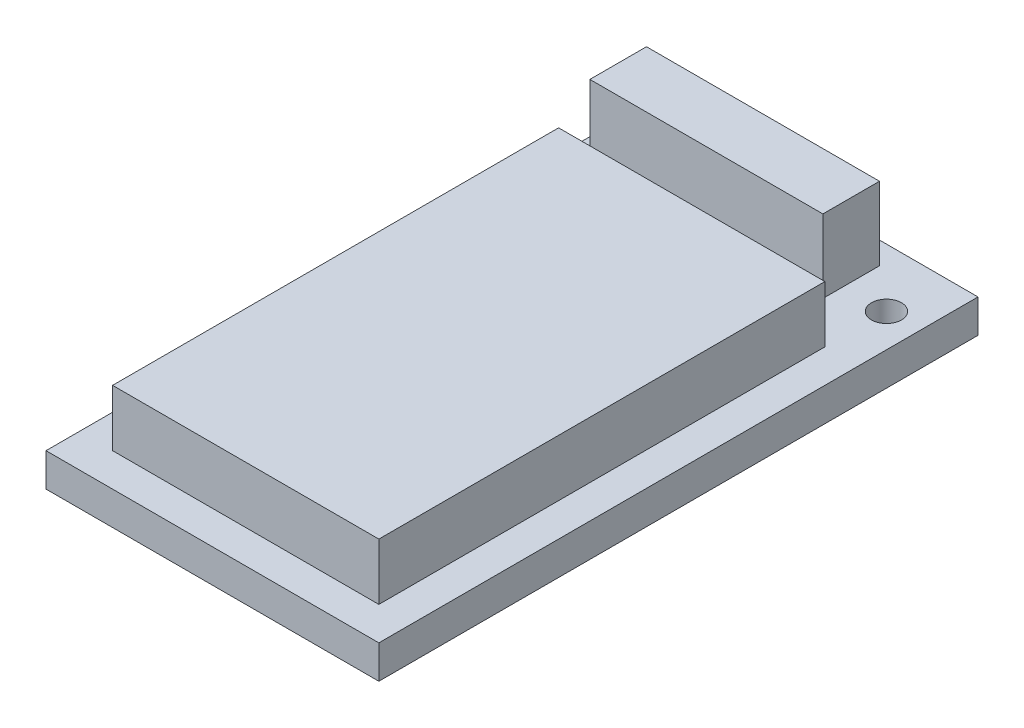
from build123d import *

# Parameters (mm, degrees)
ESQUISSE1_W                         = 10
ESQUISSE1_H                         = 18
BOSS_EXTRU_1_DEPTH                  = 1
ESQUISSE2_W                         = 8
ESQUISSE2_H                         = 13.4
BOSS_EXTRU_2_DEPTH                  = 1.7
ESQUISSE3_W                         = 7
ESQUISSE3_H                         = 1.7
BOSS_EXTRU_3_DEPTH                  = 2.2
DIAM_TRE_DU_PER_AGE_0_9_0_9_1_D     = 0.9
DIAM_TRE_DU_PER_AGE_0_9_0_9_1_DEPTH = 3.2


with BuildPart() as part:
    # Esquisse1 → Boss.-Extru.1 (new body)
    with BuildSketch(Plane(origin=(0, 1, 0), x_dir=(1, 0, 0), z_dir=(0, 1, 0))):
        Rectangle(ESQUISSE1_W, ESQUISSE1_H)
    extrude(amount=-BOSS_EXTRU_1_DEPTH)

    # Esquisse2 → Boss.-Extru.2 (add)
    with BuildSketch(Plane(origin=(0, 1, 0), x_dir=(-1, 0, 0), z_dir=(0, 1, 0))):
        with Locations((0, 1.3)):
            Rectangle(ESQUISSE2_W, ESQUISSE2_H)
    extrude(amount=BOSS_EXTRU_2_DEPTH)

    # Esquisse3 → Boss.-Extru.3 (add)
    with BuildSketch(Plane(origin=(0, 1, 0), x_dir=(-1, 0, 0), z_dir=(0, 1, 0))):
        with Locations((0.79, -7.48)):
            Rectangle(ESQUISSE3_W, ESQUISSE3_H)
    extrude(amount=BOSS_EXTRU_3_DEPTH)

    # Diamètre du perçage Ø0.9 (0.9)1
    with Locations(Plane(origin=(0, 0, 0), x_dir=(-1, 0, 0), z_dir=(0, -1, 0))):
        with Locations((-4, 7.25)):
            Hole(DIAM_TRE_DU_PER_AGE_0_9_0_9_1_D / 2, depth=DIAM_TRE_DU_PER_AGE_0_9_0_9_1_DEPTH)


solid = part.part
